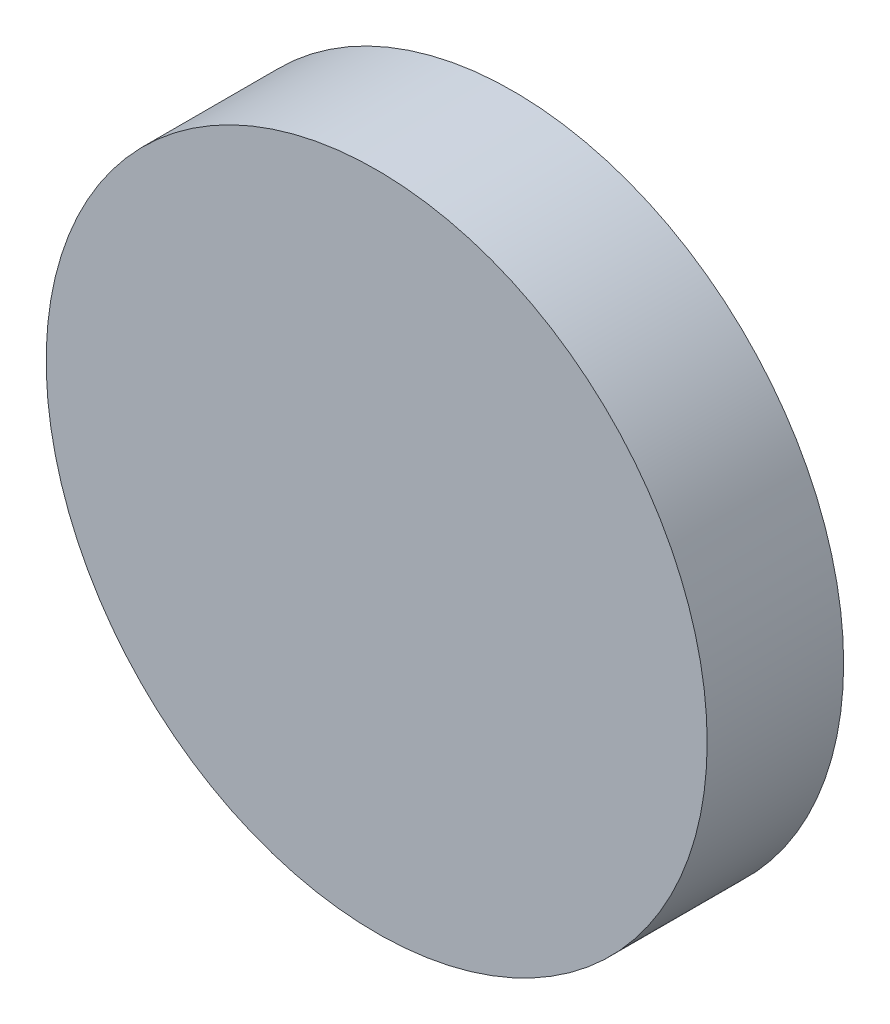
from build123d import *

# Parameters (mm, degrees)
SK_CORE_R      = 38.44925
EXT_CORE_DEPTH = 7.9375


with BuildPart() as part:
    # Sk_core → Ext_core (new, symmetric)
    with BuildSketch(Plane.XY):
        with Locations((38.481, -19.05)):
            Circle(SK_CORE_R)
    extrude(amount=EXT_CORE_DEPTH, both=True)


solid = part.part
